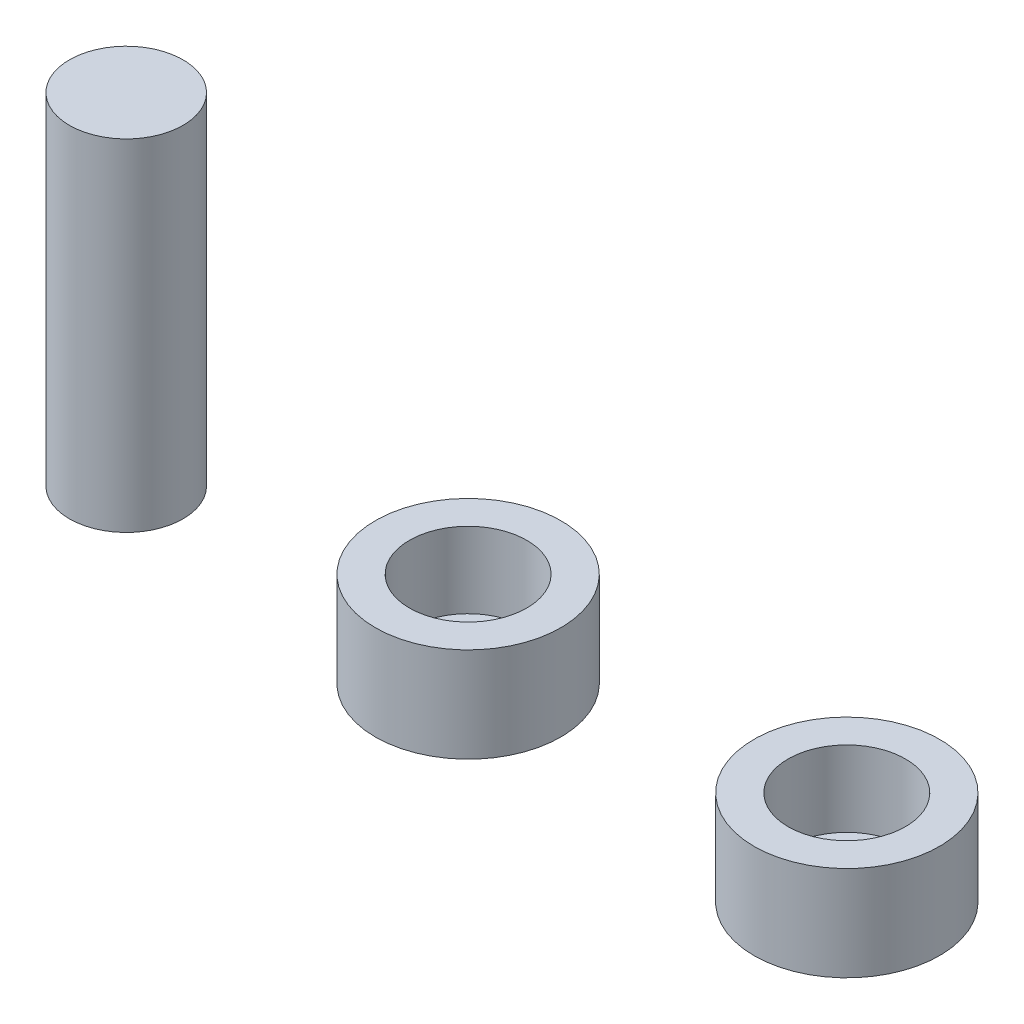
from build123d import *

# Parameters (mm, degrees)
SKETCH1_R           = 2.45
BOSS_EXTRUDE1_DEPTH = 2.5
SKETCH2_R           = 1.5
BOSS_EXTRUDE2_DEPTH = 9
SKETCH4_R           = 1.55
CUT_EXTRUDE1_DEPTH  = 2


with BuildPart() as part:
    # Sketch1 → Boss-Extrude1 (new body)
    with BuildSketch(Plane(origin=(0, 0, 0), x_dir=(1, 0, 0), z_dir=(0, 1, 0))):
        with Locations(Location((0, 0, 0), (0, 0, 270))):
            Circle(SKETCH1_R)
    extrude(amount=BOSS_EXTRUDE1_DEPTH)

    # Sketch4 → Cut-Extrude1 (cut)
    with BuildSketch(Plane(origin=(0, 2.5, 0), x_dir=(1, 0, 0), z_dir=(0, 1, 0))):
        with Locations(Location((0, 0, 0), (0, 0, 270))):
            Circle(SKETCH4_R)
    extrude(amount=-CUT_EXTRUDE1_DEPTH, mode=Mode.SUBTRACT)


with BuildPart() as body_2:
    # Sketch2 → Boss-Extrude2 (new body)
    with BuildSketch(Plane(origin=(0, 0, 0), x_dir=(1, 0, 0), z_dir=(0, 1, 0))):
        with Locations(Location((-9.027296586, 0, 0), (0, 0, 270))):
            Circle(SKETCH2_R)
    extrude(amount=BOSS_EXTRUDE2_DEPTH)


with BuildPart() as body_3:
    # Mirror1: mirrored copy
    add(part.part.mirror(Plane(origin=(5, 0, 0), x_dir=(0, 0, 1), z_dir=(1, 0, 0))))


solid = Compound([part.part, body_2.part, body_3.part])
